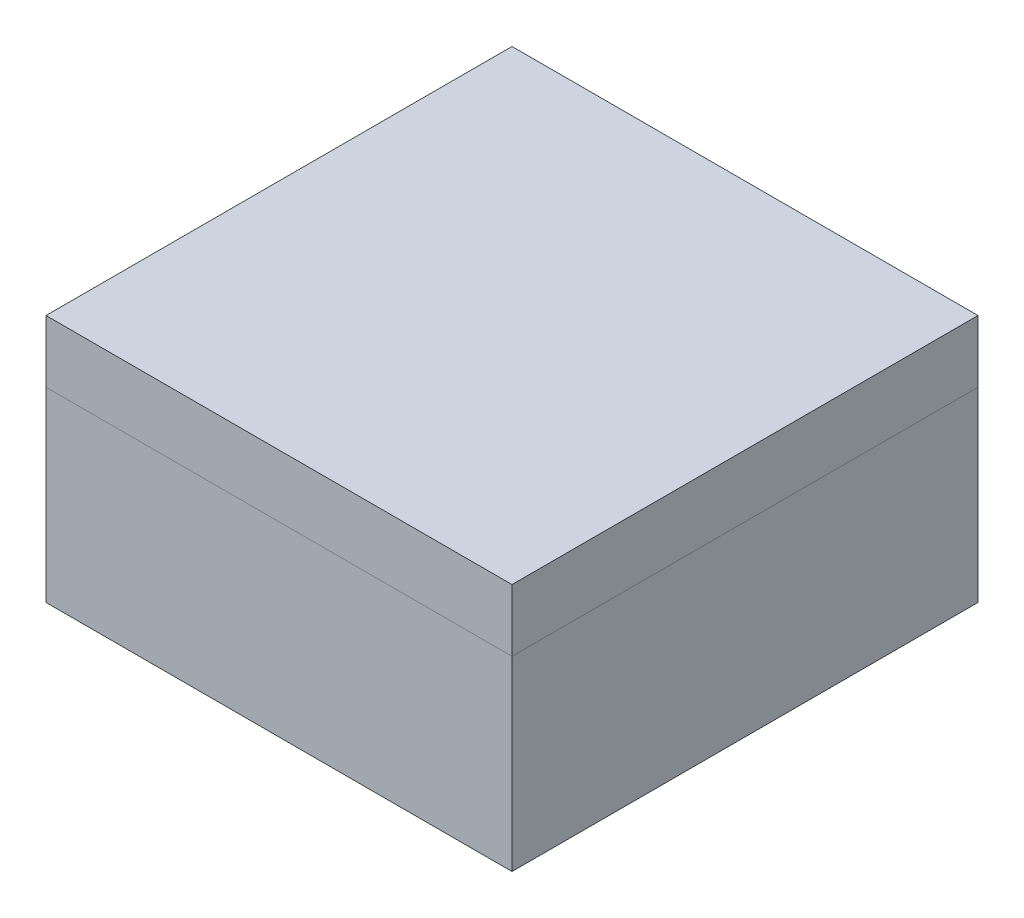
from build123d import *

# Parameters (mm, degrees)
SKETCH_1_W          = 15
SKETCH_1_H          = 15
EXTRUDE_1_DEPTH     = 5
SKETCH_2_R          = 4.1
CUT_EXTRUDE_1_DEPTH = 6
SKETCH_3_W          = 15
SKETCH_3_H          = 15
EXTRUDE_2_DEPTH     = 1
SKETCH_4_W          = 15
SKETCH_4_H          = 15
EXTRUDE_3_DEPTH     = 2


with BuildPart() as part:
    # 草图1 → 凸台-拉伸1 (new body)
    with BuildSketch(Plane(origin=(0, 0, 0), x_dir=(1, 0, 0), z_dir=(0, 1, 0))):
        Rectangle(SKETCH_1_W, SKETCH_1_H)
    extrude(amount=EXTRUDE_1_DEPTH)

    # 草图2 → 切除-拉伸1 (cut)
    with BuildSketch(Plane(origin=(0, 5, 0), x_dir=(1, 0, 0), z_dir=(0, 1, 0))):
        with Locations(Location((0, 0, 0), (0, 0, 270))):
            Circle(SKETCH_2_R)
    extrude(amount=-CUT_EXTRUDE_1_DEPTH, mode=Mode.SUBTRACT)

    # 草图3 → 凸台-拉伸2 (add)
    with BuildSketch(Plane(origin=(0, 5, 0), x_dir=(1, 0, 0), z_dir=(0, 1, 0))):
        Rectangle(SKETCH_3_W, SKETCH_3_H)
    extrude(amount=EXTRUDE_2_DEPTH)


with BuildPart() as body_2:
    # 草图4 → 凸台-拉伸3 (new body)
    with BuildSketch(Plane(origin=(0, 6, 0), x_dir=(1, 0, 0), z_dir=(0, 1, 0))):
        Rectangle(SKETCH_4_W, SKETCH_4_H)
    extrude(amount=EXTRUDE_3_DEPTH)


solid = Compound([part.part, body_2.part])
